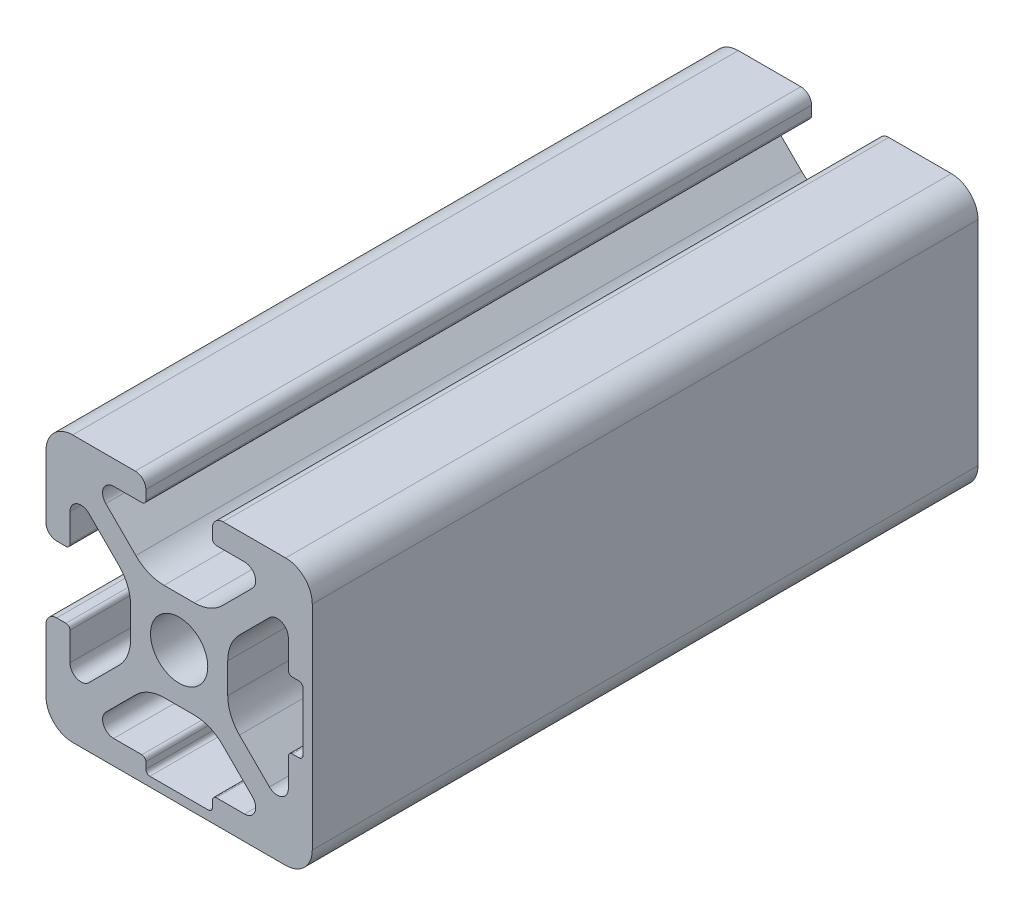
from build123d import *

# Parameters (mm, degrees)
ESQUISSE1_R        = 2.15
BOSS_EXTRU_1_DEPTH = 50


with BuildPart() as part:
    # Esquisse1 → Boss.-Extru.1 (new body)
    with BuildSketch(Plane(origin=(0, 0, 0), x_dir=(-1, 0, 0), z_dir=(0, 0, -1))):
        with BuildLine():
            Line((-17.999994246, 0), (-1.999994246, 0))
            ThreePointArc((-1.999994246, 0), (-0.585780683, 0.585786438), (5.754e-06, 2))
            Line((5.754e-06, 2), (5.754e-06, 6.699994246))
            ThreePointArc((5.754e-06, 6.699994246), (-0.234308821, 7.265679671), (-0.799994246, 7.499994246))
            Line((-0.799994246, 7.499994246), (-1.499994246, 7.499994246))
            ThreePointArc((-1.499994246, 7.499994246), (-1.71212628, 7.41212628), (-1.799994246, 7.199994246))
            Line((-1.799994246, 7.199994246), (-1.799994246, 5.081575939))
            ThreePointArc((-1.799994246, 5.081575939), (-2.31333985, 4.313299949), (-3.21958317, 4.493562953))
            Line((-3.21958317, 4.493562953), (-5.471314589, 6.745294373))
            ThreePointArc((-5.471314589, 6.745294373), (-6.121632843, 7.718564419), (-6.349994246, 8.866614716))
            Line((-6.349994246, 8.866614716), (-6.349994246, 11.133385284))
            ThreePointArc((-6.349994246, 11.133385284), (-6.121632843, 12.281435581), (-5.471314589, 13.254705627))
            Line((-5.471314589, 13.254705627), (-3.21958317, 15.506437047))
            ThreePointArc((-3.21958317, 15.506437047), (-2.31333985, 15.686700051), (-1.799994246, 14.918424061))
            Line((-1.799994246, 14.918424061), (-1.799994246, 12.799994246))
            ThreePointArc((-1.799994246, 12.799994246), (-1.71212628, 12.587862211), (-1.499994246, 12.499994246))
            Line((-1.499994246, 12.499994246), (-0.799994246, 12.499994246))
            ThreePointArc((-0.799994246, 12.499994246), (-0.234308821, 12.734308821), (5.754e-06, 13.299994246))
            Line((5.754e-06, 13.299994246), (5.754e-06, 18))
            ThreePointArc((5.754e-06, 18), (-0.585780683, 19.414213562), (-1.999994246, 20))
            Line((-1.999994246, 20), (-6.699994246, 20))
            ThreePointArc((-6.699994246, 20), (-7.265679671, 19.765685425), (-7.499994246, 19.2))
            Line((-7.499994246, 19.2), (-7.499994246, 18.5))
            ThreePointArc((-7.499994246, 18.5), (-7.41212628, 18.287867966), (-7.199994246, 18.2))
            Line((-7.199994246, 18.2), (-5.081570185, 18.2))
            ThreePointArc((-5.081570185, 18.2), (-4.313294195, 17.686654396), (-4.493557199, 16.780411076))
            Line((-4.493557199, 16.780411076), (-6.745288618, 14.528679656))
            ThreePointArc((-6.745288618, 14.528679656), (-7.718558665, 13.878361402), (-8.866608962, 13.65))
            Line((-8.866608962, 13.65), (-11.13337953, 13.65))
            ThreePointArc((-11.13337953, 13.65), (-12.281429827, 13.878361402), (-13.254699873, 14.528679656))
            Line((-13.254699873, 14.528679656), (-15.506431292, 16.780411076))
            ThreePointArc((-15.506431292, 16.780411076), (-15.686694297, 17.686654396), (-14.918418307, 18.2))
            Line((-14.918418307, 18.2), (-12.799994246, 18.2))
            ThreePointArc((-12.799994246, 18.2), (-12.587862211, 18.287867966), (-12.499994246, 18.5))
            Line((-12.499994246, 18.5), (-12.499994246, 19.2))
            ThreePointArc((-12.499994246, 19.2), (-12.734308821, 19.765685425), (-13.299994246, 20))
            Line((-13.299994246, 20), (-17.999994246, 20))
            ThreePointArc((-17.999994246, 20), (-19.414207808, 19.414213562), (-19.999994246, 18))
            Line((-19.999994246, 18), (-19.999994246, 2))
            ThreePointArc((-19.999994246, 2), (-19.414207808, 0.585786438), (-17.999994246, 0))
        make_face()
        with Locations(Location((-10, 10, 0), (0, 0, 180))):
            Circle(ESQUISSE1_R, mode=Mode.SUBTRACT)
        with BuildLine():
            Line((-16.778984489, 15.506192283), (-14.528680848, 13.255888642))
            ThreePointArc((-14.528680848, 13.255888642), (-13.878362594, 12.282618596), (-13.650001192, 11.134568298))
            Line((-13.650001192, 11.134568298), (-13.650001192, 8.865430016))
            ThreePointArc((-13.650001192, 8.865430016), (-13.878362594, 7.717379719), (-14.528680848, 6.744109673))
            Line((-14.528680848, 6.744109673), (-16.778991435, 4.493799086))
            ThreePointArc((-16.778991435, 4.493799086), (-17.686141031, 4.313355812), (-18.2, 5.082400105))
            Line((-18.2, 5.082400105), (-18.2, 7.199994246))
            ThreePointArc((-18.2, 7.199994246), (-18.287867966, 7.41212628), (-18.5, 7.499994246))
            Line((-18.5, 7.499994246), (-19, 7.499994246))
            ThreePointArc((-19, 7.499994246), (-19.212132034, 7.587862211), (-19.3, 7.799994246))
            Line((-19.3, 7.799994246), (-19.3, 12.199994246))
            ThreePointArc((-19.3, 12.199994246), (-19.212132034, 12.41212628), (-19, 12.499994246))
            Line((-19, 12.499994246), (-18.5, 12.499994246))
            ThreePointArc((-18.5, 12.499994246), (-18.287867966, 12.587862211), (-18.2, 12.799994246))
            Line((-18.2, 12.799994246), (-18.2, 14.917588386))
            ThreePointArc((-18.2, 14.917588386), (-17.68613852, 15.686636439), (-16.778984489, 15.506192283))
        make_face(mode=Mode.SUBTRACT)
        with BuildLine():
            Line((-15.506192283, 3.221015511), (-13.25588745, 5.471320344))
            ThreePointArc((-13.25588745, 5.471320344), (-12.282617404, 6.121638598), (-11.134567107, 6.35))
            Line((-11.134567107, 6.35), (-8.865432893, 6.35))
            ThreePointArc((-8.865432893, 6.35), (-7.717382596, 6.121638598), (-6.74411255, 5.471320344))
            Line((-6.74411255, 5.471320344), (-4.493800771, 3.221008565))
            ThreePointArc((-4.493800771, 3.221008565), (-4.313357497, 2.313858969), (-5.082401791, 1.8))
            Line((-5.082401791, 1.8), (-7.199994246, 1.8))
            ThreePointArc((-7.199994246, 1.8), (-7.41212628, 1.712132034), (-7.499994246, 1.5))
            Line((-7.499994246, 1.5), (-7.499994246, 1))
            ThreePointArc((-7.499994246, 1), (-7.587862211, 0.787867966), (-7.799994246, 0.7))
            Line((-7.799994246, 0.7), (-12.199994246, 0.7))
            ThreePointArc((-12.199994246, 0.7), (-12.41212628, 0.787867966), (-12.499994246, 1))
            Line((-12.499994246, 1), (-12.499994246, 1.5))
            ThreePointArc((-12.499994246, 1.5), (-12.587862211, 1.712132034), (-12.799994246, 1.8))
            Line((-12.799994246, 1.8), (-14.917588386, 1.8))
            ThreePointArc((-14.917588386, 1.8), (-15.686636439, 2.31386148), (-15.506192283, 3.221015511))
        make_face(mode=Mode.SUBTRACT)
    extrude(amount=-BOSS_EXTRU_1_DEPTH)


solid = part.part
